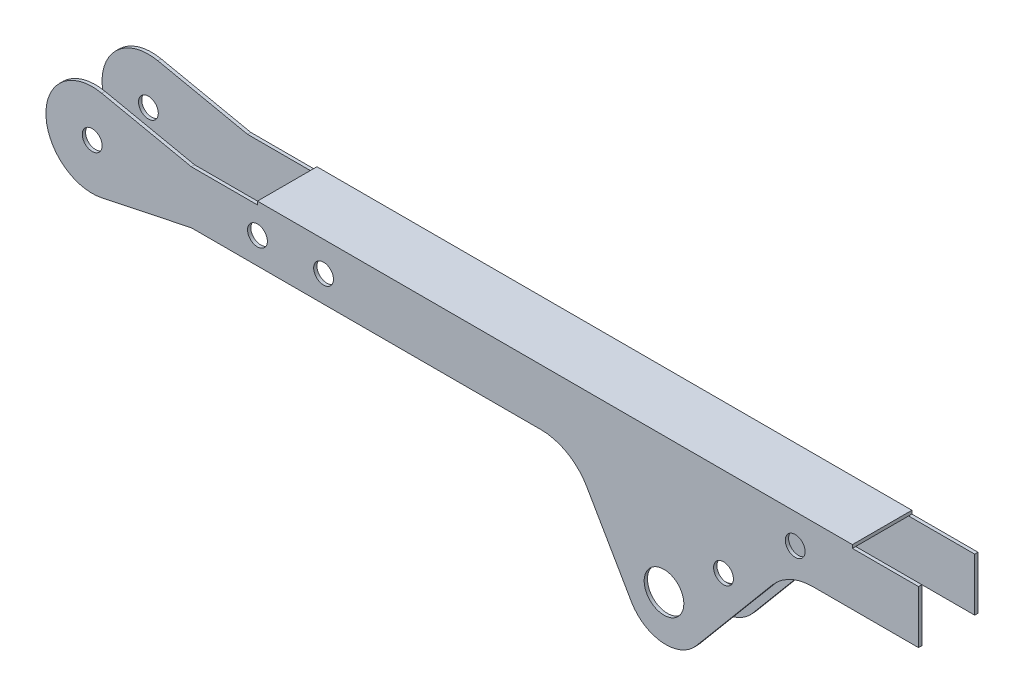
from build123d import *

# Parameters (mm, degrees)
SKETCH_1_R      = 1.5
SKETCH_1_R_2    = 3
EXTRUDE_1_DEPTH = 0.5
SKETCH_3_R      = 1.5
SKETCH_3_R_2    = 3
EXTRUDE_2_DEPTH = 0.5
SKETCH_4_W      = 90
SKETCH_4_H      = 9
EXTRUDE_3_DEPTH = 0.5
FILLET_1_R      = 8
FILLET_2_R      = 6


with BuildPart() as part:
    # 草图1 → 凸台-拉伸1 (new body)
    with BuildSketch(Plane.XY):
        with BuildLine():
            Line((-28.937588447, 11.863865809), (81.062411553, 11.863865809))
            Line((81.062411553, 11.863865809), (81.062411553, 3.863865809))
            Line((81.062411553, 3.863865809), (61.338833841, 3.863865809))
            Line((61.338833841, 3.863865809), (41.922203683, -19.275972939))
            Line((41.922203683, -19.275972939), (28.562411553, 3.863865809))
            Line((28.562411553, 3.863865809), (-28.937588447, 3.863865809))
            Line((-28.937588447, 3.863865809), (-42.497668866, 1.013564239))
            ThreePointArc((-42.497668866, 1.013564239), (-50.937588447, 7.863865809), (-42.497668866, 14.714167379))
            Line((-42.497668866, 14.714167379), (-28.937588447, 11.863865809))
        make_face()
        with Locations((-43.937588447, 7.863865809)):
            Circle(SKETCH_1_R, mode=Mode.SUBTRACT)
        with Locations((42.562411553, -8.136134191)):
            Circle(SKETCH_1_R_2, mode=Mode.SUBTRACT)
        with Locations((51.562411553, -1.136134191)):
            Circle(SKETCH_1_R, mode=Mode.SUBTRACT)
        with Locations((-18.937588447, 7.863865809)):
            Circle(SKETCH_1_R, mode=Mode.SUBTRACT)
        with Locations((-8.937588447, 7.863865809)):
            Circle(SKETCH_1_R, mode=Mode.SUBTRACT)
        with Locations((62.409410938, 7.863865809)):
            Circle(SKETCH_1_R, mode=Mode.SUBTRACT)
    extrude(amount=EXTRUDE_1_DEPTH)



with BuildPart() as body_2:
    # 草图3 → 凸台-拉伸2 (new body)
    with BuildSketch(Plane.XY.offset(-8)):
        with BuildLine():
            Line((41.922203683, -19.275972939), (61.338833841, 3.863865809))
            Line((61.338833841, 3.863865809), (81.062411553, 3.863865809))
            Line((81.062411553, 3.863865809), (81.062411553, 11.863865809))
            Line((81.062411553, 11.863865809), (-28.937588447, 11.863865809))
            Line((-28.937588447, 11.863865809), (-42.497668866, 14.714167379))
            ThreePointArc((-42.497668866, 14.714167379), (-50.937588447, 7.863865809), (-42.497668866, 1.013564239))
            Line((-42.497668866, 1.013564239), (-28.937588447, 3.863865809))
            Line((-28.937588447, 3.863865809), (28.562411553, 3.863865809))
            Line((28.562411553, 3.863865809), (41.922203683, -19.275972939))
        make_face()
        with Locations((51.562411553, -1.136134191)):
            Circle(SKETCH_3_R, mode=Mode.SUBTRACT)
        with Locations((42.562411553, -8.136134191)):
            Circle(SKETCH_3_R_2, mode=Mode.SUBTRACT)
        with Locations((-43.937588447, 7.863865809)):
            Circle(SKETCH_3_R, mode=Mode.SUBTRACT)
        with Locations((62.409410938, 7.863865809)):
            Circle(SKETCH_3_R, mode=Mode.SUBTRACT)
        with Locations((-8.937588447, 7.863865809)):
            Circle(SKETCH_3_R, mode=Mode.SUBTRACT)
        with Locations((-18.937588447, 7.863865809)):
            Circle(SKETCH_3_R, mode=Mode.SUBTRACT)
    extrude(amount=-EXTRUDE_2_DEPTH)


with BuildPart() as part_1:
    add(part.part)

    add(body_2.part)  # 凸台-拉伸3 merges body 2
    # 草图4 → 凸台-拉伸3 (add)
    with BuildSketch(Plane(origin=(0, 11.863865809, 0), x_dir=(1, 0, 0), z_dir=(0, 1, 0))):
        with Locations((26.062411553, 4)):
            Rectangle(SKETCH_4_W, SKETCH_4_H)
    extrude(amount=EXTRUDE_3_DEPTH)

    # 圆角1
    fillet_1_edges = [part_1.edges().sort_by_distance(p)[0] for p in [
        (61.338833841, 3.863865809, 0.25),
        (28.562411553, 3.863865809, 0.25),
        (28.562411553, 3.863865809, -8.25),
        (61.338833841, 3.863865809, -8.25),
    ]]
    fillet(fillet_1_edges, radius=FILLET_1_R)

    # 圆角2
    fillet_2_edges = [part_1.edges().sort_by_distance(p)[0] for p in [
        (41.922203683, -19.275972939, 0.25),
        (41.922203683, -19.275972939, -8.25),
    ]]
    fillet(fillet_2_edges, radius=FILLET_2_R)


solid = part_1.part
